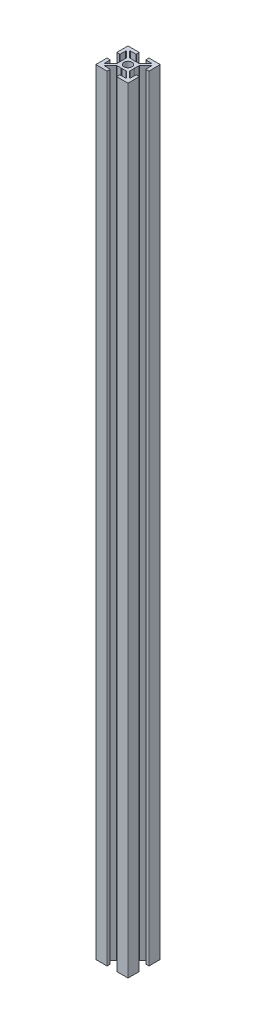
from build123d import *

# Parameters (mm, degrees)
SKETCH1_R           = 2.5
BOSS_EXTRUDE1_DEPTH = 480


with BuildPart() as part:
    # Sketch1 → Boss-Extrude1 (new body)
    with BuildSketch(Plane(origin=(0, 0, 0), x_dir=(1, 0, 0), z_dir=(0, 1, 0))):
        with BuildLine():
            Line((-2.997918472, 4.058578644), (-6.597918472, 7.658578644))
            ThreePointArc((-6.597918472, 7.658578644), (-6.621415508, 7.686854412), (-6.639339828, 7.718953455))
            ThreePointArc((-6.639339828, 7.718953455), (-6.656497116, 7.8), (-6.639339828, 7.881046545))
            ThreePointArc((-6.639339828, 7.881046545), (-6.565562901, 7.967644429), (-6.456497116, 8))
            Line((-6.456497116, 8), (-3.2, 8))
            ThreePointArc((-3.2, 8), (-3.058578644, 8.058578644), (-3, 8.2))
            Line((-3, 8.2), (-3, 9.8))
            ThreePointArc((-3, 9.8), (-3.058578644, 9.941421356), (-3.2, 10))
            Line((-3.2, 10), (-9.8, 10))
            ThreePointArc((-9.8, 10), (-9.941421356, 9.941421356), (-10, 9.8))
            Line((-10, 9.8), (-10, 3.2))
            ThreePointArc((-10, 3.2), (-9.941421356, 3.058578644), (-9.8, 3))
            Line((-9.8, 3), (-8.2, 3))
            ThreePointArc((-8.2, 3), (-8.058578644, 3.058578644), (-8, 3.2))
            Line((-8, 3.2), (-8, 6.456497116))
            ThreePointArc((-8, 6.456497116), (-7.967644429, 6.565562901), (-7.881046545, 6.639339828))
            ThreePointArc((-7.881046545, 6.639339828), (-7.8, 6.656497116), (-7.718953455, 6.639339828))
            ThreePointArc((-7.718953455, 6.639339828), (-7.686854412, 6.621415508), (-7.658578644, 6.597918472))
            Line((-7.658578644, 6.597918472), (-4.058578644, 2.997918472))
            ThreePointArc((-4.058578644, 2.997918472), (-4.015224093, 2.933033802), (-4, 2.856497116))
            Line((-4, 2.856497116), (-4, 0.130901699))
            ThreePointArc((-4, 0.130901699), (-3.99253254, 0.104615144), (-3.97236068, 0.08618034))
            Line((-3.97236068, 0.08618034), (-3.8, 0))
            Line((-3.8, 0), (-3.97236068, -0.08618034))
            ThreePointArc((-3.97236068, -0.08618034), (-3.99253254, -0.104615144), (-4, -0.130901699))
            Line((-4, -0.130901699), (-4, -2.856497116))
            ThreePointArc((-4, -2.856497116), (-4.015224093, -2.933033802), (-4.058578644, -2.997918472))
            Line((-4.058578644, -2.997918472), (-7.658578644, -6.597918472))
            ThreePointArc((-7.658578644, -6.597918472), (-7.686854412, -6.621415508), (-7.718953455, -6.639339828))
            ThreePointArc((-7.718953455, -6.639339828), (-7.8, -6.656497116), (-7.881046545, -6.639339828))
            ThreePointArc((-7.881046545, -6.639339828), (-7.967644429, -6.565562901), (-8, -6.456497116))
            Line((-8, -6.456497116), (-8, -3.2))
            ThreePointArc((-8, -3.2), (-8.058578644, -3.058578644), (-8.2, -3))
            Line((-8.2, -3), (-9.8, -3))
            ThreePointArc((-9.8, -3), (-9.941421356, -3.058578644), (-10, -3.2))
            Line((-10, -3.2), (-10, -9.8))
            ThreePointArc((-10, -9.8), (-9.941421356, -9.941421356), (-9.8, -10))
            Line((-9.8, -10), (-3.2, -10))
            ThreePointArc((-3.2, -10), (-3.058578644, -9.941421356), (-3, -9.8))
            Line((-3, -9.8), (-3, -8.2))
            ThreePointArc((-3, -8.2), (-3.058578644, -8.058578644), (-3.2, -8))
            Line((-3.2, -8), (-6.456497116, -8))
            ThreePointArc((-6.456497116, -8), (-6.565562901, -7.967644429), (-6.639339828, -7.881046545))
            ThreePointArc((-6.639339828, -7.881046545), (-6.656497116, -7.8), (-6.639339828, -7.718953455))
            ThreePointArc((-6.639339828, -7.718953455), (-6.621415508, -7.686854412), (-6.597918472, -7.658578644))
            Line((-6.597918472, -7.658578644), (-2.997918472, -4.058578644))
            ThreePointArc((-2.997918472, -4.058578644), (-2.933033802, -4.015224093), (-2.856497116, -4))
            Line((-2.856497116, -4), (-0.211803399, -4))
            ThreePointArc((-0.211803399, -4), (-0.200315753, -3.998662449), (-0.189442719, -3.99472136))
            Line((-0.189442719, -3.99472136), (0, -3.9))
            Line((0, -3.9), (0.189442719, -3.99472136))
            ThreePointArc((0.189442719, -3.99472136), (0.200315753, -3.998662449), (0.211803399, -4))
            Line((0.211803399, -4), (2.856497116, -4))
            ThreePointArc((2.856497116, -4), (2.933033802, -4.015224093), (2.997918472, -4.058578644))
            Line((2.997918472, -4.058578644), (6.597918472, -7.658578644))
            ThreePointArc((6.597918472, -7.658578644), (6.621415508, -7.686854412), (6.639339828, -7.718953455))
            ThreePointArc((6.639339828, -7.718953455), (6.656497116, -7.8), (6.639339828, -7.881046545))
            ThreePointArc((6.639339828, -7.881046545), (6.565562901, -7.967644429), (6.456497116, -8))
            Line((6.456497116, -8), (3.2, -8))
            ThreePointArc((3.2, -8), (3.058578644, -8.058578644), (3, -8.2))
            Line((3, -8.2), (3, -9.8))
            ThreePointArc((3, -9.8), (3.058578644, -9.941421356), (3.2, -10))
            Line((3.2, -10), (9.8, -10))
            ThreePointArc((9.8, -10), (9.941421356, -9.941421356), (10, -9.8))
            Line((10, -9.8), (10, -3.2))
            ThreePointArc((10, -3.2), (9.941421356, -3.058578644), (9.8, -3))
            Line((9.8, -3), (8.2, -3))
            ThreePointArc((8.2, -3), (8.058578644, -3.058578644), (8, -3.2))
            Line((8, -3.2), (8, -6.456497116))
            ThreePointArc((8, -6.456497116), (7.967644429, -6.565562901), (7.881046545, -6.639339828))
            ThreePointArc((7.881046545, -6.639339828), (7.8, -6.656497116), (7.718953455, -6.639339828))
            ThreePointArc((7.718953455, -6.639339828), (7.686854412, -6.621415508), (7.658578644, -6.597918472))
            Line((7.658578644, -6.597918472), (4.058578644, -2.997918472))
            ThreePointArc((4.058578644, -2.997918472), (4.015224093, -2.933033802), (4, -2.856497116))
            Line((4, -2.856497116), (4, -0.130901699))
            ThreePointArc((4, -0.130901699), (3.99253254, -0.104615144), (3.97236068, -0.08618034))
            Line((3.97236068, -0.08618034), (3.8, 0))
            Line((3.8, 0), (3.97236068, 0.08618034))
            ThreePointArc((3.97236068, 0.08618034), (3.99253254, 0.104615144), (4, 0.130901699))
            Line((4, 0.130901699), (4, 2.856497116))
            ThreePointArc((4, 2.856497116), (4.015224093, 2.933033802), (4.058578644, 2.997918472))
            Line((4.058578644, 2.997918472), (7.658578644, 6.597918472))
            ThreePointArc((7.658578644, 6.597918472), (7.686854412, 6.621415508), (7.718953455, 6.639339828))
            ThreePointArc((7.718953455, 6.639339828), (7.8, 6.656497116), (7.881046545, 6.639339828))
            ThreePointArc((7.881046545, 6.639339828), (7.967644429, 6.565562901), (8, 6.456497116))
            Line((8, 6.456497116), (8, 3.2))
            ThreePointArc((8, 3.2), (8.058578644, 3.058578644), (8.2, 3))
            Line((8.2, 3), (9.8, 3))
            ThreePointArc((9.8, 3), (9.941421356, 3.058578644), (10, 3.2))
            Line((10, 3.2), (10, 9.8))
            ThreePointArc((10, 9.8), (9.941421356, 9.941421356), (9.8, 10))
            Line((9.8, 10), (3.2, 10))
            ThreePointArc((3.2, 10), (3.058578644, 9.941421356), (3, 9.8))
            Line((3, 9.8), (3, 8.2))
            ThreePointArc((3, 8.2), (3.058578644, 8.058578644), (3.2, 8))
            Line((3.2, 8), (6.456497116, 8))
            ThreePointArc((6.456497116, 8), (6.565562901, 7.967644429), (6.639339828, 7.881046545))
            ThreePointArc((6.639339828, 7.881046545), (6.656497116, 7.8), (6.639339828, 7.718953455))
            ThreePointArc((6.639339828, 7.718953455), (6.621415508, 7.686854412), (6.597918472, 7.658578644))
            Line((6.597918472, 7.658578644), (2.997918472, 4.058578644))
            ThreePointArc((2.997918472, 4.058578644), (2.933033802, 4.015224093), (2.856497116, 4))
            Line((2.856497116, 4), (0.211803399, 4))
            ThreePointArc((0.211803399, 4), (0.200315753, 3.998662449), (0.189442719, 3.99472136))
            Line((0.189442719, 3.99472136), (0, 3.9))
            Line((0, 3.9), (-0.189442719, 3.99472136))
            ThreePointArc((-0.189442719, 3.99472136), (-0.200315753, 3.998662449), (-0.211803399, 4))
            Line((-0.211803399, 4), (-2.856497116, 4))
            ThreePointArc((-2.856497116, 4), (-2.933033802, 4.015224093), (-2.997918472, 4.058578644))
        make_face()
        Circle(SKETCH1_R, mode=Mode.SUBTRACT)
    extrude(amount=BOSS_EXTRUDE1_DEPTH)


solid = part.part
